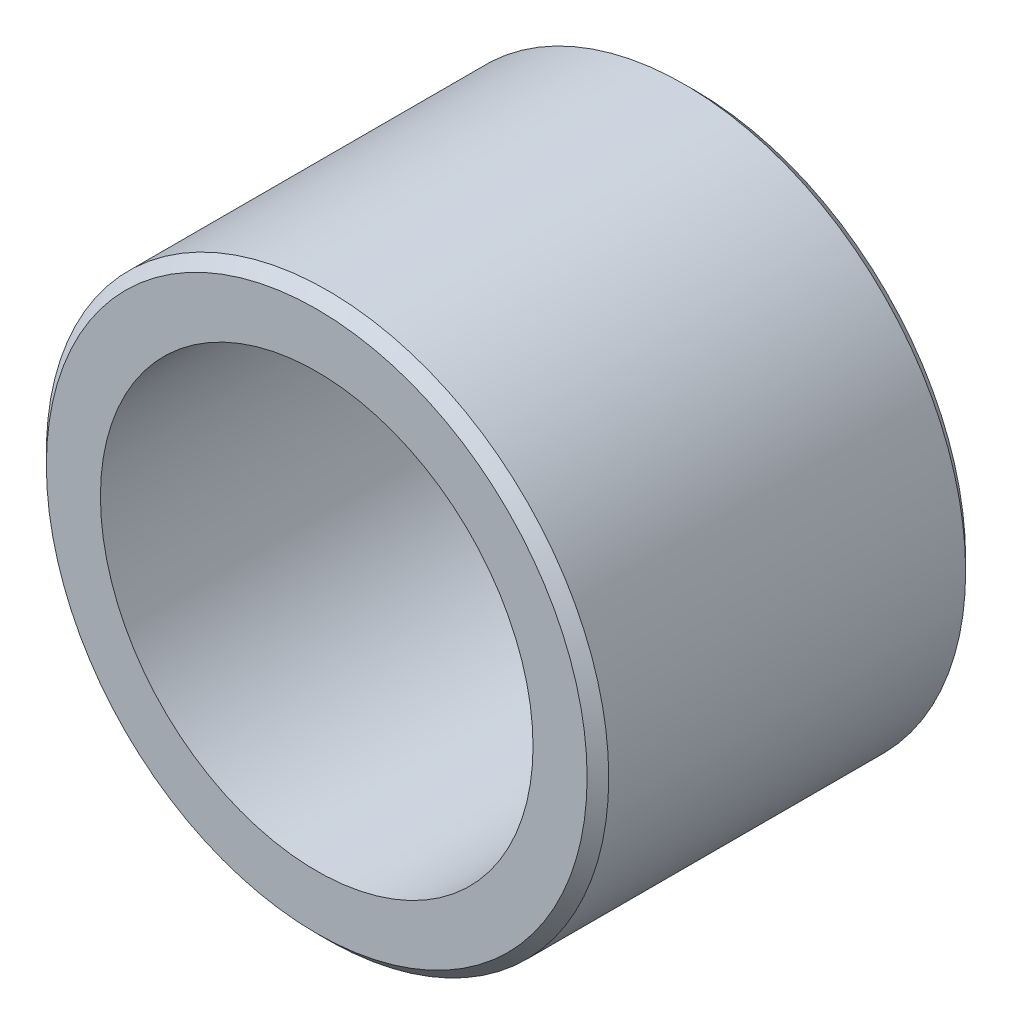
from build123d import *

# Parameters (mm, degrees)
SKETCH_1_R          = 13
EXTRUDE_1_DEPTH     = 17.5
SKETCH_2_R          = 10
CUT_EXTRUDE_1_DEPTH = 17.5
CHAMFER_1_SIZE      = 0.5


with BuildPart() as part:
    # 草图1 → 凸台-拉伸1 (new body)
    with BuildSketch(Plane.XY):
        Circle(SKETCH_1_R)
    extrude(amount=EXTRUDE_1_DEPTH)

    # 草图2 → 切除-拉伸1 (cut)
    with BuildSketch(Plane.XY.offset(17.5)):
        Circle(SKETCH_2_R)
    extrude(amount=-CUT_EXTRUDE_1_DEPTH, mode=Mode.SUBTRACT)

    # 倒角1
    chamfer_1_edges = [part.edges().sort_by_distance(p)[0] for p in [
        (-13, 0, 0),
        (-13, 0, 17.5),
    ]]
    chamfer(chamfer_1_edges, length=CHAMFER_1_SIZE)


solid = part.part
